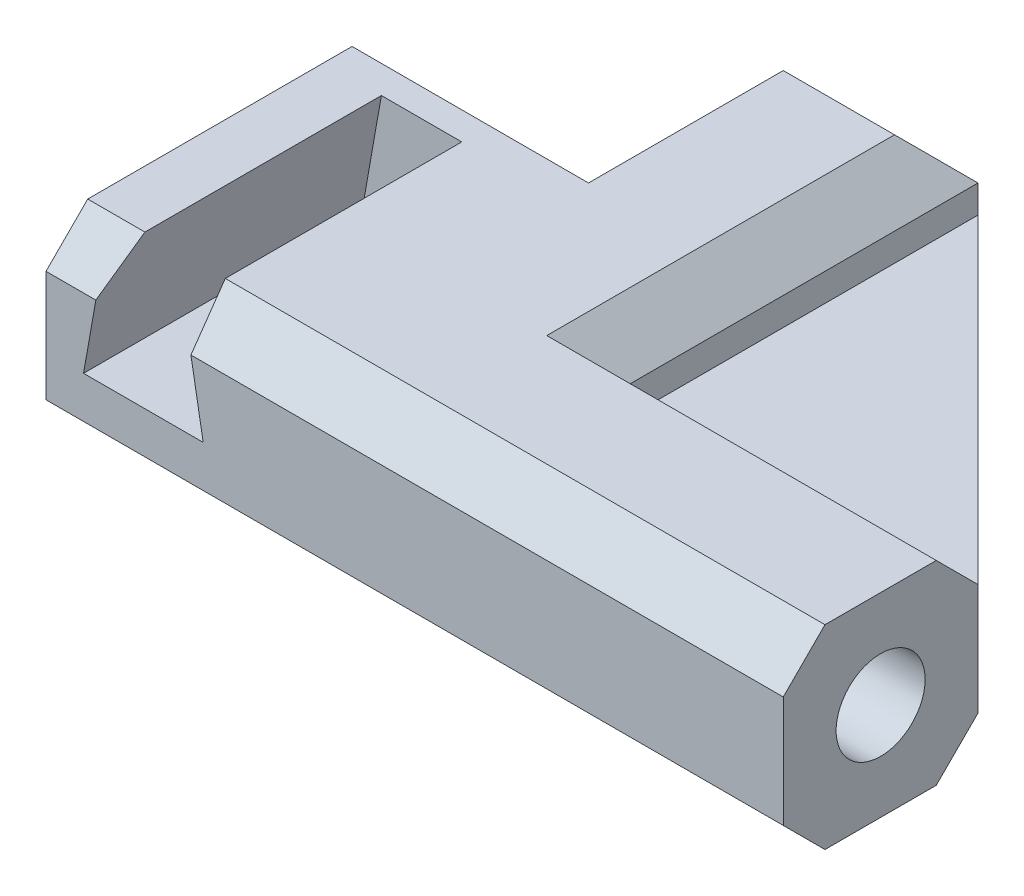
from build123d import *

# Parameters (mm, degrees)
BOSS_EXTRUDE1_DEPTH  = 3.5
SKETCH2_R            = 1.6
CUT_EXTRUDE1_DEPTH   = 14
SKETCH3_R            = 1.6
CUT_EXTRUDE2_DEPTH   = 14
BOSS_EXTRUDE2_DEPTH  = 1
BOSS_EXTRUDE13_START = -19.5
BOSS_EXTRUDE13_DEPTH = 10
BOSS_EXTRUDE14_DEPTH = 1
CHAMFER7_SIZE        = 1.5


with BuildPart() as part:
    # Sketch1 → Boss-Extrude1 (new, symmetric)
    with BuildSketch(Plane(origin=(0, 0, 0), x_dir=(1, 0, 0), z_dir=(0, 1, 0))):
        Polygon((-3.5, 16), (-3.5, -3.5), (16, -3.5), (16, 3.5), (3.5, 3.5), (3.5, 16), align=None)
    extrude(amount=BOSS_EXTRUDE1_DEPTH, both=True)

    # Sketch2 → Cut-Extrude1 (cut)
    with BuildSketch(Plane(origin=(0, 0, -16), x_dir=(-1, 0, 0), z_dir=(0, 0, -1))):
        Circle(SKETCH2_R)
    extrude(amount=-CUT_EXTRUDE1_DEPTH, mode=Mode.SUBTRACT)

    # Sketch3 → Cut-Extrude2 (cut)
    with BuildSketch(Plane(origin=(16, 0, 0), x_dir=(0, 0, -1), z_dir=(1, 0, 0))):
        Circle(SKETCH3_R)
    extrude(amount=-CUT_EXTRUDE2_DEPTH, mode=Mode.SUBTRACT)

    # Sketch4 → Boss-Extrude2 (add, symmetric)
    with BuildSketch(Plane(origin=(0, 0, 0), x_dir=(1, 0, 0), z_dir=(0, 1, 0))):
        Polygon((3.5, 16), (16, 3.5), (3.5, 3.5), align=None)
    extrude(amount=BOSS_EXTRUDE2_DEPTH, both=True)

    # Sketch16 → Boss-Extrude13 (add)
    with BuildSketch(Plane(origin=(0, 0, -16), x_dir=(-1, 0, 0), z_dir=(0, 0, -1)).offset(BOSS_EXTRUDE13_START)):
        Polygon((3.5, -3.5), (3.5, 3.5), (5.555307923, 3.5), (4.85, -0.5), (9.15, -0.5), (8.444692077, 3.5), (10.5, 3.5), (10.5, -3.5), align=None)
    extrude(amount=BOSS_EXTRUDE13_DEPTH)

    # Sketch17 → Boss-Extrude14 (add)
    with BuildSketch(Plane(origin=(0, 0, -6.5), x_dir=(-1, 0, 0), z_dir=(0, 0, -1))):
        Polygon((5.555307923, 3.5), (3.5, 3.5), (3.5, -3.5), (10.5, -3.5), (10.5, 3.5), (8.444692077, 3.5), (9.15, -0.5), (4.85, -0.5), align=None)
        Polygon((9.15, -0.5), (8.444692077, 3.5), (5.555307923, 3.5), (4.85, -0.5), align=None)
    extrude(amount=BOSS_EXTRUDE14_DEPTH)

    # Chamfer7
    chamfer7_edges = [part.edges().sort_by_distance(p)[0] for p in [
        (5.222346039, 3.5, 3.5),
        (9.75, 3.5, -3.5),
        (3.5, 3.5, -9.75),
        (-10.5, -3.5, -2),
        (-9.472346039, 3.5, 3.5),
        (0, 3.5, -16),
        (3.5, -3.5, -9.75),
        (9.75, -3.5, -3.5),
        (2.75, -3.5, 3.5),
        (-3.5, -3.5, -11.75),
        (-3.5, 3.5, -11.75),
    ]]
    chamfer(chamfer7_edges, length=CHAMFER7_SIZE)


solid = part.part
